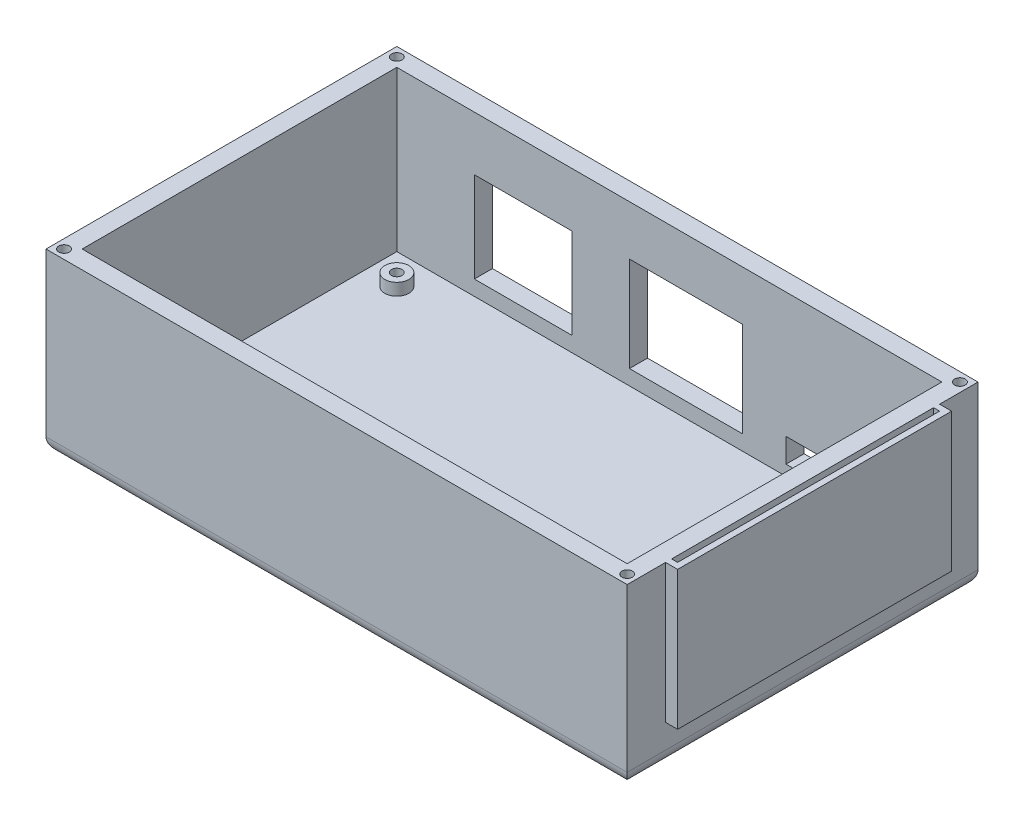
from build123d import *

# Parameters (mm, degrees)
SKETCH1_W               = 193
SKETCH1_H               = 116.5
BOSS_EXTRUDE5_DEPTH     = 59
SHELL4_T                = -6
SKETCH6_R               = 4
SKETCH6_R_2             = 1.75
BOSS_EXTRUDE6_DEPTH     = 4
CUT_EXTRUDE1_DEPTH      = 38
CUT_EXTRUDE1_DEPTH_BACK = 34
SKETCH9_R               = 1.75
CUT_EXTRUDE2_DEPTH      = 7
FILLET2_R               = 5
SKETCH12_W              = 6
SKETCH12_H              = 6.5
BOSS_EXTRUDE7_DEPTH     = 18
SKETCH15_W              = 6
SKETCH15_H              = 7.5
BOSS_EXTRUDE8_DEPTH     = 5
SKETCH16_W              = 7.5
SKETCH16_H              = 6
SKETCH16_W_2            = 6.75
SKETCH16_W_3            = 3.5
BOSS_EXTRUDE9_DEPTH     = 7.5
SKETCH17_W              = 6
SKETCH17_H              = 31.5
BOSS_EXTRUDE10_DEPTH    = 4
SKETCH18_W              = 6
SKETCH18_H              = 1.5
BOSS_EXTRUDE11_DEPTH    = 1.5
SKETCH19_W              = 2
SKETCH19_H              = 6
BOSS_EXTRUDE12_DEPTH    = 30
SKETCH20_W              = 9
SKETCH20_H              = 2.5
BOSS_EXTRUDE13_DEPTH    = 6
SKETCH21_W              = 6
SKETCH21_H              = 7.5
CUT_EXTRUDE3_DEPTH      = 3
SKETCH22_W              = 17.5
SKETCH22_H              = 6
CUT_EXTRUDE4_DEPTH      = 2
SKETCH23_W              = 6
SKETCH23_H              = 5
CUT_EXTRUDE5_DEPTH      = 2
SKETCH24_W              = 11
SKETCH24_H              = 6
CUT_EXTRUDE6_DEPTH      = 1.5
SKETCH25_W              = 11
SKETCH25_H              = 6
CUT_EXTRUDE7_DEPTH      = 1.5
SKETCH27_W              = 17.5
SKETCH27_H              = 6
CUT_EXTRUDE8_DEPTH      = 1.5
SKETCH32_W              = 91
SKETCH32_H              = 46
BOSS_EXTRUDE15_DEPTH    = 4
SKETCH33_W              = 2
SKETCH33_H              = 87
CUT_EXTRUDE10_DEPTH     = 44
SKETCH34_W              = 8
SKETCH34_H              = 6
CUT_EXTRUDE11_DEPTH     = 1.5
SKETCH35_W              = 6
SKETCH35_H              = 30
BOSS_EXTRUDE16_DEPTH    = 11
SKETCH36_W              = 6
SKETCH36_H              = 30
BOSS_EXTRUDE17_DEPTH    = 7
SKETCH37_W              = 6
SKETCH37_H              = 31.5
BOSS_EXTRUDE18_DEPTH    = 6
SKETCH38_W              = 6
SKETCH38_H              = 31.5
BOSS_EXTRUDE19_DEPTH    = 7


with BuildPart() as part:
    # Sketch1 → Boss-Extrude5 (new body)
    with BuildSketch(Plane(origin=(0, 0, 0), x_dir=(1, 0, 0), z_dir=(0, 1, 0))):
        with Locations((10.696891192, -0.426165803)):
            Rectangle(SKETCH1_W, SKETCH1_H)
    extrude(amount=BOSS_EXTRUDE5_DEPTH)

    # Shell4
    shell4_openings = [part.faces().sort_by_distance(p)[0] for p in [
        (10.696891192, 59, 0.426165803),
    ]]
    offset(amount=SHELL4_T, openings=shell4_openings, kind=Kind.INTERSECTION)

    # Sketch6 → Boss-Extrude6 (add)
    # profile 1 of 4: a face of its own
    with BuildSketch(Plane(origin=(0, 6, 0), x_dir=(1, 0, 0), z_dir=(0, 1, 0))):
        with Locations(Location((-69.803108808, 41.823834197, 0), (0, 0, 270))):
            Circle(SKETCH6_R)
        with Locations(Location((-69.803108808, 41.823834197, 0), (0, 0, 270))):
            Circle(SKETCH6_R_2, mode=Mode.SUBTRACT)
    # profile 2 of 4: a face of its own
    with BuildSketch(Plane(origin=(0, 6, 0), x_dir=(1, 0, 0), z_dir=(0, 1, 0))):
        with Locations(Location((90.196891192, 41.823834197, 0), (0, 0, 270))):
            Circle(SKETCH6_R)
        with Locations(Location((90.196891192, 41.823834197, 0), (0, 0, 270))):
            Circle(SKETCH6_R_2, mode=Mode.SUBTRACT)
    # profile 3 of 4: a face of its own
    with BuildSketch(Plane(origin=(0, 6, 0), x_dir=(1, 0, 0), z_dir=(0, 1, 0))):
        with Locations(Location((90.196891192, -38.426165803, 0), (0, 0, 270))):
            Circle(SKETCH6_R)
        with Locations(Location((90.196891192, -38.426165803, 0), (0, 0, 270))):
            Circle(SKETCH6_R_2, mode=Mode.SUBTRACT)
    # profile 4 of 4: a face of its own
    with BuildSketch(Plane(origin=(0, 6, 0), x_dir=(1, 0, 0), z_dir=(0, 1, 0))):
        with Locations(Location((-69.803108808, -38.426165803, 0), (0, 0, 270))):
            Circle(SKETCH6_R)
        with Locations(Location((-69.803108808, -38.426165803, 0), (0, 0, 270))):
            Circle(SKETCH6_R_2, mode=Mode.SUBTRACT)
    extrude(amount=BOSS_EXTRUDE6_DEPTH)

    # Sketch8 → Cut-Extrude1 (cut, two sides: drawn at the far end of the back side and taken through both)
    with BuildSketch(Plane(origin=(0, 0, -57.823834197), x_dir=(-1, 0, 0), z_dir=(0, 0, -1)).offset(-CUT_EXTRUDE1_DEPTH_BACK)):
        Polygon((-85.946891192, 18.5), (-100.196891192, 18.5), (-100.196891192, 11), (-85.946891192, 11), (-63.946891192, 11), (-45.946891192, 11), (10.053108808, 11), (61.053108808, 11), (61.053108808, 41), (10.053108808, 41), (10.053108808, 42.5), (-45.946891192, 42.5), (-45.946891192, 25), (-63.946891192, 25), (-63.946891192, 18.5), align=None)
    extrude(amount=CUT_EXTRUDE1_DEPTH + CUT_EXTRUDE1_DEPTH_BACK, mode=Mode.SUBTRACT)

    # Sketch9 → Cut-Extrude2 (cut)
    with BuildSketch(Plane(origin=(0, 59, 0), x_dir=(1, 0, 0), z_dir=(0, 1, 0))):
        with Locations(Location((-82.803108808, 54.823834197, 0), (0, 0, 270))):
            Circle(SKETCH9_R)
        with Locations(Location((104.196891192, 54.823834197, 0), (0, 0, 270))):
            Circle(SKETCH9_R)
        with Locations(Location((-82.803108808, -55.676165803, 0), (0, 0, 270))):
            Circle(SKETCH9_R)
        with Locations(Location((104.196891192, -55.676165803, 0), (0, 0, 270))):
            Circle(SKETCH9_R)
    extrude(amount=-CUT_EXTRUDE2_DEPTH, mode=Mode.SUBTRACT)

    # Fillet2
    fillet2_edges = [part.edges().sort_by_distance(p)[0] for p in [
        (10.696891192, 0, -57.823834197),
        (107.196891192, 0, 0.426165803),
        (10.696891192, 0, 58.676165803),
        (-85.803108808, 0, 0.426165803),
    ]]
    fillet(fillet2_edges, radius=FILLET2_R)

    # Sketch12 → Boss-Extrude7 (add)
    with BuildSketch(Plane.ZY.offset(-63.946891192)):
        with Locations((-54.823834197, 21.75)):
            Rectangle(SKETCH12_W, SKETCH12_H)
    extrude(amount=BOSS_EXTRUDE7_DEPTH)

    # Sketch15 → Boss-Extrude8 (add)
    with BuildSketch(Plane.ZY.offset(-100.196891192)):
        with Locations((-54.823834197, 14.75)):
            Rectangle(SKETCH15_W, SKETCH15_H)
    extrude(amount=BOSS_EXTRUDE8_DEPTH)

    # Sketch16 → Boss-Extrude9 (add)
    with BuildSketch(Plane.XZ.offset(-18.5)):
        with Locations((83.446891192, -54.823834197)):
            Rectangle(SKETCH16_W, SKETCH16_H)
        with Locations((61.821891192, -54.823834197)):
            Rectangle(SKETCH16_W_2, SKETCH16_H)
        with Locations((47.696891192, -54.823834197)):
            Rectangle(SKETCH16_W_3, SKETCH16_H)
    extrude(amount=BOSS_EXTRUDE9_DEPTH)

    # Sketch17 → Boss-Extrude10 (add)
    with BuildSketch(Plane.ZY.offset(-45.946891192)):
        with Locations((-54.823834197, 26.75)):
            Rectangle(SKETCH17_W, SKETCH17_H)
    extrude(amount=BOSS_EXTRUDE10_DEPTH)

    # Sketch18 → Boss-Extrude11 (add)
    with BuildSketch(Plane(origin=(-10.053108808, 0, 0), x_dir=(0, 0, -1), z_dir=(1, 0, 0))):
        with Locations((54.823834197, 41.75)):
            Rectangle(SKETCH18_W, SKETCH18_H)
    extrude(amount=BOSS_EXTRUDE11_DEPTH)

    # Sketch19 → Boss-Extrude12 (add)
    with BuildSketch(Plane.XZ.offset(-41)):
        with Locations((-9.553108808, -54.823834197)):
            Rectangle(SKETCH19_W, SKETCH19_H)
    extrude(amount=BOSS_EXTRUDE12_DEPTH)

    # Sketch20 → Boss-Extrude13 (add)
    with BuildSketch(Plane(origin=(0, 0, -57.823834197), x_dir=(-1, 0, 0), z_dir=(0, 0, -1))):
        with Locations((-53.946891192, 17.25)):
            Rectangle(SKETCH20_W, SKETCH20_H)
    extrude(amount=-BOSS_EXTRUDE13_DEPTH)

    # Sketch21 → Cut-Extrude3 (cut)
    with BuildSketch(Plane.ZY.offset(-79.696891192)):
        with Locations((-54.823834197, 14.75)):
            Rectangle(SKETCH21_W, SKETCH21_H)
    extrude(amount=-CUT_EXTRUDE3_DEPTH, mode=Mode.SUBTRACT)

    # Sketch22 → Cut-Extrude4 (cut)
    with BuildSketch(Plane.XZ.offset(-18.5)):
        with Locations((73.946891192, -54.823834197)):
            Rectangle(SKETCH22_W, SKETCH22_H)
    extrude(amount=-CUT_EXTRUDE4_DEPTH, mode=Mode.SUBTRACT)

    # Sketch23 → Cut-Extrude5 (cut)
    with BuildSketch(Plane.ZY.offset(-58.446891192)):
        with Locations((-54.823834197, 13.5)):
            Rectangle(SKETCH23_W, SKETCH23_H)
    extrude(amount=-CUT_EXTRUDE5_DEPTH, mode=Mode.SUBTRACT)

    # Sketch24 → Cut-Extrude6 (cut)
    with BuildSketch(Plane.XZ.offset(-16)):
        with Locations((54.946891192, -54.823834197)):
            Rectangle(SKETCH24_W, SKETCH24_H)
    extrude(amount=-CUT_EXTRUDE6_DEPTH, mode=Mode.SUBTRACT)

    # Sketch25 → Cut-Extrude7 (cut)
    with BuildSketch(Plane(origin=(0, 11, 0), x_dir=(1, 0, 0), z_dir=(0, 1, 0))):
        with Locations((54.946891192, 54.823834197)):
            Rectangle(SKETCH25_W, SKETCH25_H)
    extrude(amount=-CUT_EXTRUDE7_DEPTH, mode=Mode.SUBTRACT)

    # Sketch27 → Cut-Extrude8 (cut)
    with BuildSketch(Plane(origin=(0, 11, 0), x_dir=(1, 0, 0), z_dir=(0, 1, 0))):
        with Locations((73.946891192, 54.823834197)):
            Rectangle(SKETCH27_W, SKETCH27_H)
    extrude(amount=-CUT_EXTRUDE8_DEPTH, mode=Mode.SUBTRACT)

    # Sketch32 → Boss-Extrude15 (add)
    with BuildSketch(Plane(origin=(107.196891192, 0, 0), x_dir=(0, 0, -1), z_dir=(1, 0, 0))):
        with Locations((-0.426165803, 36)):
            Rectangle(SKETCH32_W, SKETCH32_H)
    extrude(amount=BOSS_EXTRUDE15_DEPTH)

    # Sketch33 → Cut-Extrude10 (cut)
    with BuildSketch(Plane(origin=(0, 59, 0), x_dir=(1, 0, 0), z_dir=(0, 1, 0))):
        with Locations((108.196891192, -0.426165803)):
            Rectangle(SKETCH33_W, SKETCH33_H)
    extrude(amount=-CUT_EXTRUDE10_DEPTH, mode=Mode.SUBTRACT)

    # Sketch34 → Cut-Extrude11 (cut)
    with BuildSketch(Plane(origin=(0, 11, 0), x_dir=(1, 0, 0), z_dir=(0, 1, 0))):
        with Locations((91.196891192, 54.823834197)):
            Rectangle(SKETCH34_W, SKETCH34_H)
    extrude(amount=-CUT_EXTRUDE11_DEPTH, mode=Mode.SUBTRACT)

    # Sketch35 → Boss-Extrude16 (add)
    with BuildSketch(Plane.ZY.offset(10.553108808)):
        with Locations((-54.823834197, 26)):
            Rectangle(SKETCH35_W, SKETCH35_H)
    extrude(amount=BOSS_EXTRUDE16_DEPTH)

    # Sketch36 → Boss-Extrude17 (add)
    with BuildSketch(Plane(origin=(-61.053108808, 0, 0), x_dir=(0, 0, -1), z_dir=(1, 0, 0))):
        with Locations((54.823834197, 26)):
            Rectangle(SKETCH36_W, SKETCH36_H)
    extrude(amount=BOSS_EXTRUDE17_DEPTH)

    # Sketch37 → Boss-Extrude18 (add)
    with BuildSketch(Plane(origin=(-8.553108808, 0, 0), x_dir=(0, 0, -1), z_dir=(1, 0, 0))):
        with Locations((54.823834197, 26.75)):
            Rectangle(SKETCH37_W, SKETCH37_H)
    extrude(amount=BOSS_EXTRUDE18_DEPTH)

    # Sketch38 → Boss-Extrude19 (add)
    with BuildSketch(Plane.ZY.offset(-41.946891192)):
        with Locations((-54.823834197, 26.75)):
            Rectangle(SKETCH38_W, SKETCH38_H)
    extrude(amount=BOSS_EXTRUDE19_DEPTH)


solid = part.part
